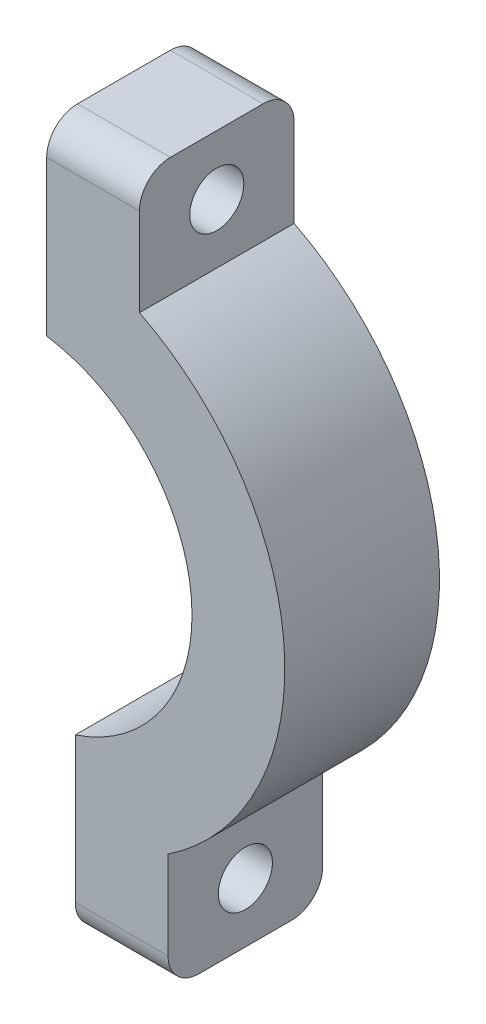
from build123d import *

# Parameters (mm, degrees)
BOSS_EXTRUDE1_DEPTH = 10
SKETCH3_R           = 1.75
CUT_EXTRUDE1_DEPTH  = 10
SKETCH2_R           = 1.75
CUT_EXTRUDE2_DEPTH  = 10
FILLET1_R           = 2


with BuildPart() as part:
    # Sketch1 → Boss-Extrude1 (new body)
    with BuildSketch(Plane.XY):
        with BuildLine():
            Line((3.5, -17.05), (3.5, -10.481054336))
            ThreePointArc((3.5, -10.481054336), (11.008967033, 0.951391014), (1.65, 10.926115504))
            Line((1.65, 10.926115504), (1.65, 20.437453856))
            Line((1.65, 20.437453856), (1.65, 22.937453856))
            Line((1.65, 22.937453856), (7.65, 22.937453856))
            Line((7.65, 22.937453856), (7.65, 15.237453856))
            ThreePointArc((7.65, 15.237453856), (17.016334424, 1.070916786), (9.5, -14.158124876))
            Line((9.5, -14.158124876), (9.5, -21.858124876))
            Line((9.5, -21.858124876), (3.5, -21.858124876))
            Line((3.5, -21.858124876), (3.5, -19.358124876))
            Line((3.5, -19.358124876), (3.5, -17.05))
        make_face()
    extrude(amount=BOSS_EXTRUDE1_DEPTH)

    # Sketch3 → Cut-Extrude1 (cut)
    with BuildSketch(Plane(origin=(9.5, 0, 0), x_dir=(0, 0, -1), z_dir=(1, 0, 0))):
        with Locations(Location((-5, -18.008124876, 0), (0, 0, 90))):
            Circle(SKETCH3_R)
    extrude(amount=-CUT_EXTRUDE1_DEPTH, mode=Mode.SUBTRACT)

    # Sketch2 → Cut-Extrude2 (cut)
    with BuildSketch(Plane(origin=(7.65, 0, 0), x_dir=(0, 0, -1), z_dir=(1, 0, 0))):
        with Locations((-5, 19.087453856)):
            Circle(SKETCH2_R)
    extrude(amount=-CUT_EXTRUDE2_DEPTH, mode=Mode.SUBTRACT)

    # Fillet1
    fillet1_edges = [part.edges().sort_by_distance(p)[0] for p in [
        (4.65, 22.937453856, 0),
        (6.5, -21.858124876, 10),
        (6.5, -21.858124876, 0),
        (4.65, 22.937453856, 10),
    ]]
    fillet(fillet1_edges, radius=FILLET1_R)


solid = part.part
